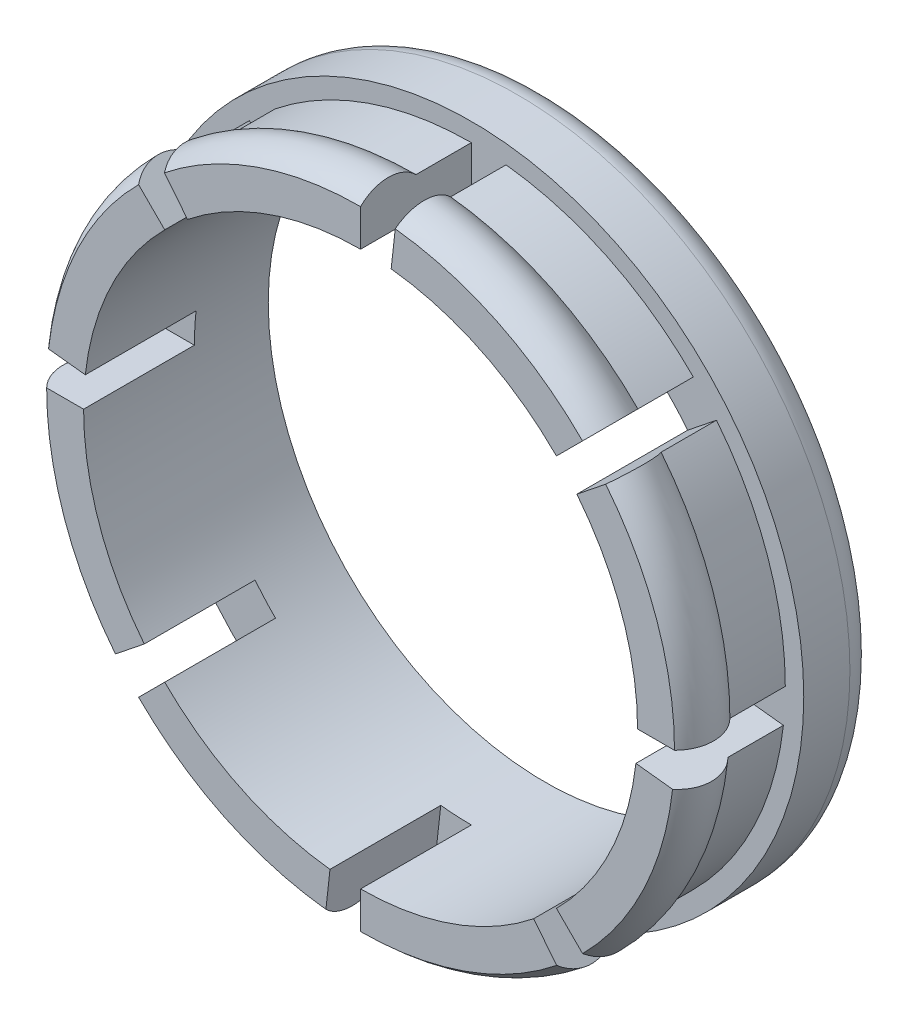
from build123d import *

# Parameters (mm, degrees)
SKETCH1_R           = 9
SKETCH1_R_2         = 7.5
BOSS_EXTRUDE1_DEPTH = 5
CUT_EXTRUDE1_REACH  = 15.675


with BuildPart() as part:
    # Sketch1 → Boss-Extrude1 (new body)
    with BuildSketch(Plane.XY):
        Circle(SKETCH1_R)
        Circle(SKETCH1_R_2, mode=Mode.SUBTRACT)
    extrude(amount=BOSS_EXTRUDE1_DEPTH)

    # Sketch2 → Cut-Revolve1 (revolve, cut)
    with BuildSketch(Plane(origin=(0, 0, 0), x_dir=(1, 0, 0), z_dir=(0, 1, 0)), mode=Mode.PRIVATE) as cut_revolve1_sk:
        with BuildLine():
            Line((-9, -5), (-8.5, -5))
            ThreePointArc((-8.5, -5), (-8.810660172, -4.25), (-8.5, -3.5))
            Line((-8.5, -3.5), (-8.5, -2))
            Line((-8.5, -2), (-9, -2))
            Line((-9, -2), (-9, -5))
        make_face()
        with BuildLine():
            Line((-8.25, 0), (-9, 0))
            Line((-9, 0), (-9, -0.75))
            ThreePointArc((-9, -0.75), (-8.780330086, -0.219669914), (-8.25, 0))
        make_face()
    revolve(cut_revolve1_sk.sketch.rotate(Axis((0, 0, 5), (0, 0, -1)), 180), axis=Axis((0, 0, 5), (0, 0, -1)), mode=Mode.SUBTRACT)

    # Cut-Extrude1: up to this face of the body (flat: up to its plane)
    cut_extrude1_end = Plane(part.part.faces().sort_by_distance((-8.754558441, 0, 2))[0])
    # Sketch3 → Cut-Extrude1 (cut, up to the picked face)
    with BuildSketch(Plane.XY.offset(5), mode=Mode.PRIVATE) as cut_extrude1_sk1:
        with BuildLine():
            Line((0, -7.5), (0, -9))
            ThreePointArc((0, -9), (-0.497703472, -8.986227866), (-0.993883735, -8.944953612))
            Line((-0.993883735, -8.944953612), (-0.828236446, -7.45412801))
            ThreePointArc((-0.828236446, -7.45412801), (-0.414752893, -7.488523221), (0, -7.5))
        make_face()
    cut_extrude1_tool1 = split(extrude(cut_extrude1_sk1.sketch, amount=-CUT_EXTRUDE1_REACH, mode=Mode.PRIVATE), bisect_by=cut_extrude1_end, keep=Keep.BOTH, mode=Mode.PRIVATE)
    # Sketch3 → Cut-Extrude1 (cut, up to the picked face)
    with BuildSketch(Plane.XY.offset(5), mode=Mode.PRIVATE) as cut_extrude1_sk2:
        with BuildLine():
            Line((-5.303300859, -5.303300859), (-6.363961031, -6.363961031))
            ThreePointArc((-6.363961031, -6.363961031), (-6.706152161, -6.002293161), (-7.027819285, -5.622255428))
            Line((-7.027819285, -5.622255428), (-5.856516071, -4.685212857))
            ThreePointArc((-5.856516071, -4.685212857), (-5.588460134, -5.001910968), (-5.303300859, -5.303300859))
        make_face()
    cut_extrude1_tool2 = split(extrude(cut_extrude1_sk2.sketch, amount=-CUT_EXTRUDE1_REACH, mode=Mode.PRIVATE), bisect_by=cut_extrude1_end, keep=Keep.BOTH, mode=Mode.PRIVATE)
    # Sketch3 → Cut-Extrude1 (cut, up to the picked face)
    with BuildSketch(Plane.XY.offset(5), mode=Mode.PRIVATE) as cut_extrude1_sk3:
        with BuildLine():
            Line((-7.5, 0), (-9, 0))
            ThreePointArc((-9, 0), (-8.986227866, 0.497703472), (-8.944953612, 0.993883735))
            Line((-8.944953612, 0.993883735), (-7.45412801, 0.828236446))
            ThreePointArc((-7.45412801, 0.828236446), (-7.488523221, 0.414752893), (-7.5, 0))
        make_face()
    cut_extrude1_tool3 = split(extrude(cut_extrude1_sk3.sketch, amount=-CUT_EXTRUDE1_REACH, mode=Mode.PRIVATE), bisect_by=cut_extrude1_end, keep=Keep.BOTH, mode=Mode.PRIVATE)
    # Sketch3 → Cut-Extrude1 (cut, up to the picked face)
    with BuildSketch(Plane.XY.offset(5), mode=Mode.PRIVATE) as cut_extrude1_sk4:
        with BuildLine():
            Line((-5.303300859, 5.303300859), (-6.363961031, 6.363961031))
            ThreePointArc((-6.363961031, 6.363961031), (-6.002293161, 6.706152161), (-5.622255428, 7.027819285))
            Line((-5.622255428, 7.027819285), (-4.685212857, 5.856516071))
            ThreePointArc((-4.685212857, 5.856516071), (-5.001910968, 5.588460134), (-5.303300859, 5.303300859))
        make_face()
    cut_extrude1_tool4 = split(extrude(cut_extrude1_sk4.sketch, amount=-CUT_EXTRUDE1_REACH, mode=Mode.PRIVATE), bisect_by=cut_extrude1_end, keep=Keep.BOTH, mode=Mode.PRIVATE)
    # Sketch3 → Cut-Extrude1 (cut, up to the picked face)
    with BuildSketch(Plane.XY.offset(5), mode=Mode.PRIVATE) as cut_extrude1_sk5:
        with BuildLine():
            Line((0, 7.5), (0, 9))
            ThreePointArc((0, 9), (0.497703472, 8.986227866), (0.993883735, 8.944953612))
            Line((0.993883735, 8.944953612), (0.828236446, 7.45412801))
            ThreePointArc((0.828236446, 7.45412801), (0.414752893, 7.488523221), (0, 7.5))
        make_face()
    cut_extrude1_tool5 = split(extrude(cut_extrude1_sk5.sketch, amount=-CUT_EXTRUDE1_REACH, mode=Mode.PRIVATE), bisect_by=cut_extrude1_end, keep=Keep.BOTH, mode=Mode.PRIVATE)
    # Sketch3 → Cut-Extrude1 (cut, up to the picked face)
    with BuildSketch(Plane.XY.offset(5), mode=Mode.PRIVATE) as cut_extrude1_sk6:
        with BuildLine():
            Line((5.303300859, -5.303300859), (6.363961031, -6.363961031))
            ThreePointArc((6.363961031, -6.363961031), (6.002293161, -6.706152161), (5.622255428, -7.027819285))
            Line((5.622255428, -7.027819285), (4.685212857, -5.856516071))
            ThreePointArc((4.685212857, -5.856516071), (5.001910968, -5.588460134), (5.303300859, -5.303300859))
        make_face()
    cut_extrude1_tool6 = split(extrude(cut_extrude1_sk6.sketch, amount=-CUT_EXTRUDE1_REACH, mode=Mode.PRIVATE), bisect_by=cut_extrude1_end, keep=Keep.BOTH, mode=Mode.PRIVATE)
    # Sketch3 → Cut-Extrude1 (cut, up to the picked face)
    with BuildSketch(Plane.XY.offset(5), mode=Mode.PRIVATE) as cut_extrude1_sk7:
        with BuildLine():
            Line((5.303300859, 5.303300859), (6.363961031, 6.363961031))
            ThreePointArc((6.363961031, 6.363961031), (6.706152161, 6.002293161), (7.027819285, 5.622255428))
            Line((7.027819285, 5.622255428), (5.856516071, 4.685212857))
            ThreePointArc((5.856516071, 4.685212857), (5.588460134, 5.001910968), (5.303300859, 5.303300859))
        make_face()
    cut_extrude1_tool7 = split(extrude(cut_extrude1_sk7.sketch, amount=-CUT_EXTRUDE1_REACH, mode=Mode.PRIVATE), bisect_by=cut_extrude1_end, keep=Keep.BOTH, mode=Mode.PRIVATE)
    # Sketch3 → Cut-Extrude1 (cut, up to the picked face)
    with BuildSketch(Plane.XY.offset(5), mode=Mode.PRIVATE) as cut_extrude1_sk8:
        with BuildLine():
            Line((7.5, 0), (9, 0))
            ThreePointArc((9, 0), (8.986227866, -0.497703472), (8.944953612, -0.993883735))
            Line((8.944953612, -0.993883735), (7.45412801, -0.828236446))
            ThreePointArc((7.45412801, -0.828236446), (7.488523221, -0.414752893), (7.5, 0))
        make_face()
    cut_extrude1_tool8 = split(extrude(cut_extrude1_sk8.sketch, amount=-CUT_EXTRUDE1_REACH, mode=Mode.PRIVATE), bisect_by=cut_extrude1_end, keep=Keep.BOTH, mode=Mode.PRIVATE)
    add(cut_extrude1_tool1.solids().sort_by(Axis((-0.457252, -8.255854, 5), (0, 0, -1)))[0], mode=Mode.SUBTRACT)
    add(cut_extrude1_tool2.solids().sort_by(Axis((-6.161096, -5.514445, 5), (0, 0, -1)))[0], mode=Mode.SUBTRACT)
    add(cut_extrude1_tool3.solids().sort_by(Axis((-8.255854, 0.457252, 5), (0, 0, -1)))[0], mode=Mode.SUBTRACT)
    add(cut_extrude1_tool4.solids().sort_by(Axis((-5.514445, 6.161096, 5), (0, 0, -1)))[0], mode=Mode.SUBTRACT)
    add(cut_extrude1_tool5.solids().sort_by(Axis((0.457252, 8.255854, 5), (0, 0, -1)))[0], mode=Mode.SUBTRACT)
    add(cut_extrude1_tool6.solids().sort_by(Axis((5.514445, -6.161096, 5), (0, 0, -1)))[0], mode=Mode.SUBTRACT)
    add(cut_extrude1_tool7.solids().sort_by(Axis((6.161096, 5.514445, 5), (0, 0, -1)))[0], mode=Mode.SUBTRACT)
    add(cut_extrude1_tool8.solids().sort_by(Axis((8.255854, -0.457252, 5), (0, 0, -1)))[0], mode=Mode.SUBTRACT)


solid = part.part
